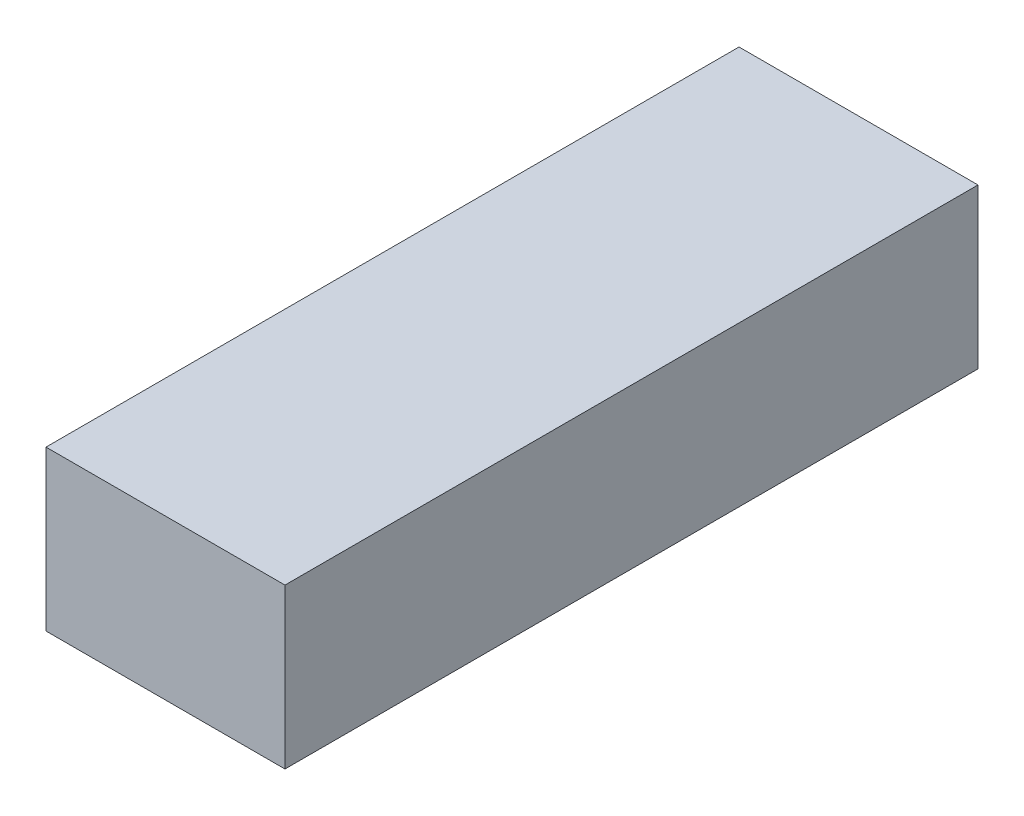
from build123d import *

# Parameters (mm, degrees)
SCHIZZO1_W                   = 30
SCHIZZO1_H                   = 20
ESTRUSIONE_ESTRUSIONE1_DEPTH = 87


with BuildPart() as part:
    # Schizzo1 → Estrusione-Estrusione1 (new body)
    with BuildSketch(Plane.XY):
        Rectangle(SCHIZZO1_W, SCHIZZO1_H)
    extrude(amount=ESTRUSIONE_ESTRUSIONE1_DEPTH)


solid = part.part
